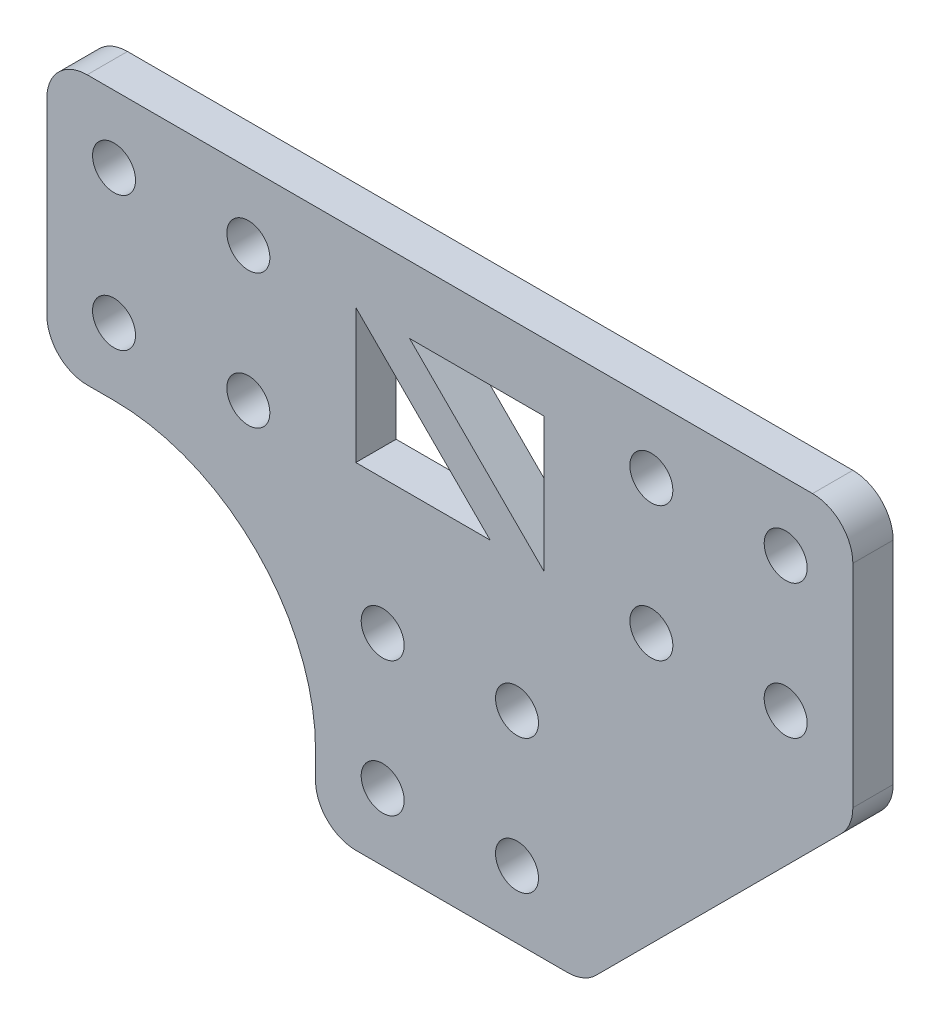
from build123d import *

# Parameters (mm, degrees)
SKETCH_1_R      = 1.6
EXTRUDE_1_DEPTH = 3
FILLET_1_R      = 3
FILLET_2_R      = 15


with BuildPart() as part:
    # 草图1 → 凸台-拉伸1 (new body)
    with BuildSketch(Plane.XY):
        Polygon((0, 0), (60, 0), (60, -20), (40, -40), (20, -40), (20, -20), (0, -20), align=None)
        with Locations((5, -5)):
            Circle(SKETCH_1_R, mode=Mode.SUBTRACT)
        with Locations(Location((15, -5, 0), (0, 0, 180))):
            Circle(SKETCH_1_R, mode=Mode.SUBTRACT)
        with Locations((15, -15)):
            Circle(SKETCH_1_R, mode=Mode.SUBTRACT)
        with Locations(Location((5, -15, 0), (0, 0, 180))):
            Circle(SKETCH_1_R, mode=Mode.SUBTRACT)
        with Locations((55, -15)):
            Circle(SKETCH_1_R, mode=Mode.SUBTRACT)
        with Locations(Location((45, -15, 0), (0, 0, 180))):
            Circle(SKETCH_1_R, mode=Mode.SUBTRACT)
        with Locations((45, -5)):
            Circle(SKETCH_1_R, mode=Mode.SUBTRACT)
        with Locations(Location((55, -5, 0), (0, 0, 180))):
            Circle(SKETCH_1_R, mode=Mode.SUBTRACT)
        with Locations((25, -35)):
            Circle(SKETCH_1_R, mode=Mode.SUBTRACT)
        with Locations(Location((35, -35, 0), (0, 0, 180))):
            Circle(SKETCH_1_R, mode=Mode.SUBTRACT)
        with Locations((35, -25)):
            Circle(SKETCH_1_R, mode=Mode.SUBTRACT)
        with Locations(Location((25, -25, 0), (0, 0, 180))):
            Circle(SKETCH_1_R, mode=Mode.SUBTRACT)
        Polygon((23, -5), (23, -15), (33, -15), align=None, mode=Mode.SUBTRACT)
        Polygon((27, -5), (37, -5), (37, -15), align=None, mode=Mode.SUBTRACT)
    extrude(amount=EXTRUDE_1_DEPTH)

    # 圆角1
    fillet_1_edges = [part.edges().sort_by_distance(p)[0] for p in [
        (0, 0, 1.5),
        (60, 0, 1.5),
        (60, -20, 1.5),
        (40, -40, 1.5),
        (20, -40, 1.5),
        (0, -20, 1.5),
    ]]
    fillet(fillet_1_edges, radius=FILLET_1_R)

    # 圆角2
    fillet_2_edges = [part.edges().sort_by_distance(p)[0] for p in [
        (20, -20, 1.5),
    ]]
    fillet(fillet_2_edges, radius=FILLET_2_R)


solid = part.part
